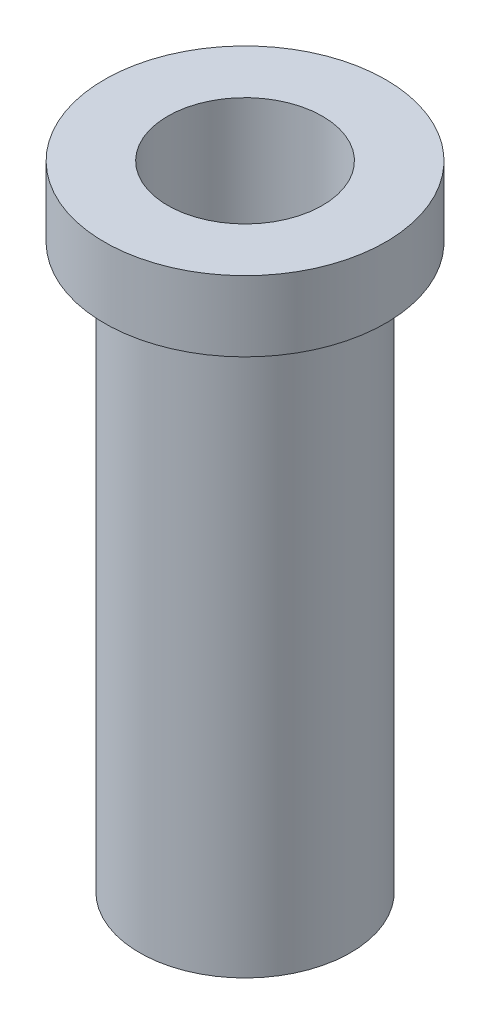
from build123d import *


with BuildPart() as part:
    # Sketch1 → Revolve1 (revolve)
    with BuildSketch(Plane.XY, mode=Mode.PRIVATE) as revolve1_sk:
        Polygon((5.5, 0), (5.5, 45), (10, 45), (10, 40), (7.5, 40), (7.5, 0), align=None)
    revolve(revolve1_sk.sketch.rotate(Axis((0, 0, 0), (0, 1, 0)), 90), axis=Axis((0, 0, 0), (0, 1, 0)))


solid = part.part
